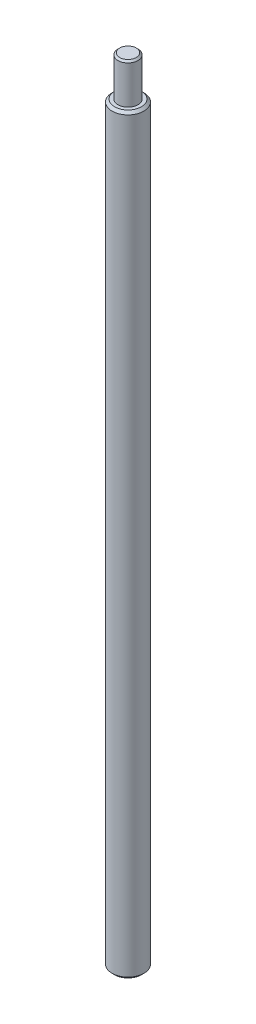
from build123d import *

# Parameters (mm, degrees)
SKETCH6_R           = 3.175
BOSS_EXTRUDE4_DEPTH = 150
SKETCH7_R           = 2
BOSS_EXTRUDE5_DEPTH = 8
CHAMFER1_SIZE       = 0.5
CHAMFER2_SIZE       = 0.35


with BuildPart() as part:
    # Sketch6 → Boss-Extrude4 (new body)
    with BuildSketch(Plane(origin=(0, 0, 0), x_dir=(1, 0, 0), z_dir=(0, 1, 0))):
        with Locations(Location((0, 0, 0), (0, 0, 270))):
            Circle(SKETCH6_R)
    extrude(amount=BOSS_EXTRUDE4_DEPTH)

    # Sketch7 → Boss-Extrude5 (add)
    with BuildSketch(Plane(origin=(0, 150, 0), x_dir=(-1, 0, 0), z_dir=(0, 1, 0))):
        with Locations(Location((0, 0, 0), (0, 0, 90))):
            Circle(SKETCH7_R)
    extrude(amount=BOSS_EXTRUDE5_DEPTH)

    # Chamfer1
    chamfer1_edges = [part.edges().sort_by_distance(p)[0] for p in [
        (0, 0, -3.175),
        (0, 150, -3.175),
    ]]
    chamfer(chamfer1_edges, length=CHAMFER1_SIZE)

    # Chamfer2
    chamfer2_edges = [part.edges().sort_by_distance(p)[0] for p in [
        (0, 158, -2),
    ]]
    chamfer(chamfer2_edges, length=CHAMFER2_SIZE)


solid = part.part
